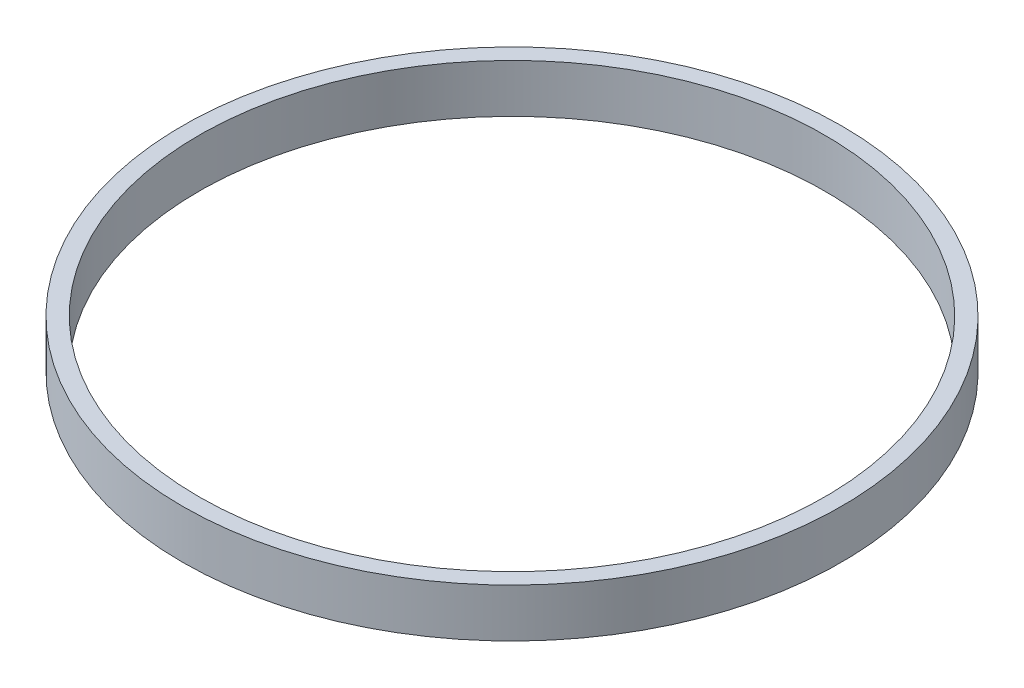
from build123d import *

# Parameters (mm, degrees)
SKETCH1_R           = 17
SKETCH1_R_2         = 16.15
BOSS_EXTRUDE1_DEPTH = 2.5


with BuildPart() as part:
    # Sketch1 → Boss-Extrude1 (new body)
    with BuildSketch(Plane(origin=(0, 0, 0), x_dir=(1, 0, 0), z_dir=(0, 1, 0))):
        with Locations(Location((0, 0, 0), (0, 0, 270))):
            Circle(SKETCH1_R)
        with Locations(Location((0, 0, 0), (0, 0, 270))):
            Circle(SKETCH1_R_2, mode=Mode.SUBTRACT)
    extrude(amount=BOSS_EXTRUDE1_DEPTH)


solid = part.part
